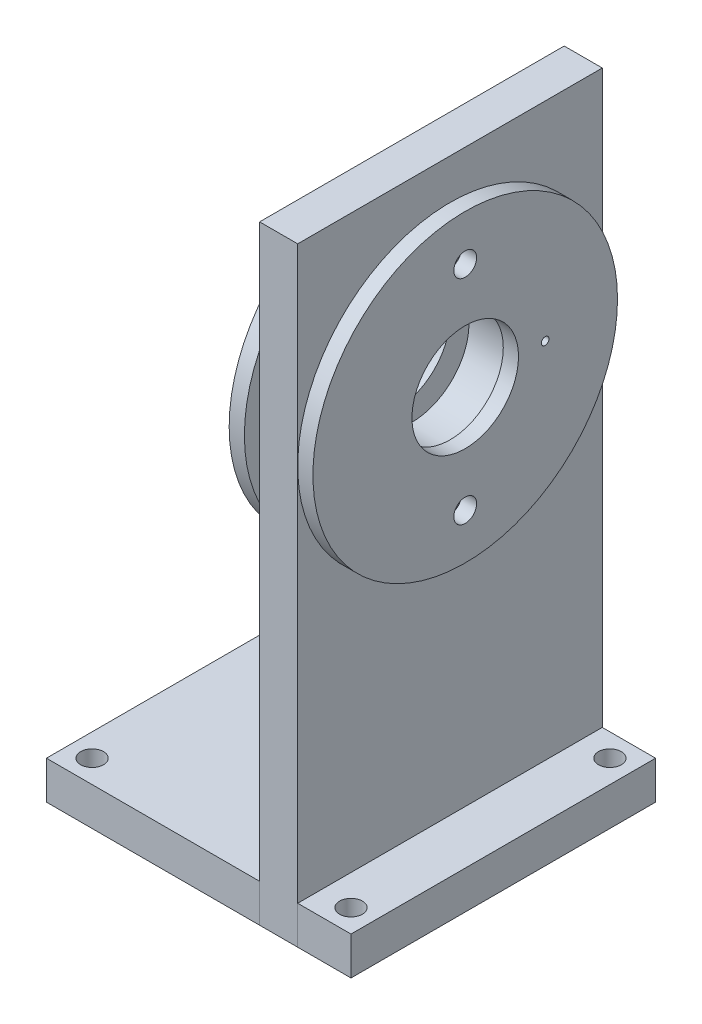
from build123d import *

# Parameters (mm, degrees)
SKETCH1_R           = 7.5
SKETCH1_R_2         = 1
BOSS_EXTRUDE1_DEPTH = 5
SKETCH2_R           = 20
SKETCH2_R_2         = 7
SKETCH2_R_3         = 0.5
SKETCH2_R_4         = 1.5
BOSS_EXTRUDE2_DEPTH = 2
SKETCH4_R           = 20
SKETCH4_R_2         = 1
SKETCH4_R_3         = 1.5
SKETCH4_R_4         = 7
BOSS_EXTRUDE3_DEPTH = 2
SKETCH6_R           = 1.5
SKETCH6_W           = 5
SKETCH6_H           = 14
BOSS_EXTRUDE4_DEPTH = 5


with BuildPart() as part:
    # Sketch1 → Boss-Extrude1 (new body)
    with BuildSketch(Plane(origin=(0, 0, 0), x_dir=(0, 0, -1), z_dir=(1, 0, 0))):
        Polygon((0, 0), (-20, 0), (-20, 80), (20, 80), (20, 0), align=None)
        with Locations((0, 54.7)):
            Circle(SKETCH1_R, mode=Mode.SUBTRACT)
        with Locations((10.5, 54.7)):
            Circle(SKETCH1_R_2, mode=Mode.SUBTRACT)
    extrude(amount=BOSS_EXTRUDE1_DEPTH)


with BuildPart() as body_2:
    # Sketch2 → Boss-Extrude2 (new body)
    with BuildSketch(Plane(origin=(5, 0, 0), x_dir=(0, 0, -1), z_dir=(1, 0, 0))):
        with Locations((0, 54.7)):
            Circle(SKETCH2_R)
        with Locations((0, 54.7)):
            Circle(SKETCH2_R_2, mode=Mode.SUBTRACT)
        with Locations((10.5, 54.7)):
            Circle(SKETCH2_R_3, mode=Mode.SUBTRACT)
        with Locations((0, 68.7)):
            Circle(SKETCH2_R_4, mode=Mode.SUBTRACT)
        with Locations(Location((0, 40.7, 0), (0, 0, 180))):
            Circle(SKETCH2_R_4, mode=Mode.SUBTRACT)
    extrude(amount=BOSS_EXTRUDE2_DEPTH)


with BuildPart() as body_3:
    # Sketch4 → Boss-Extrude3 (new body)
    with BuildSketch(Plane.ZY.offset(2)):
        with Locations((0, 54.7)):
            Circle(SKETCH4_R)
        with Locations((-10.5, 54.7)):
            Circle(SKETCH4_R_2, mode=Mode.SUBTRACT)
        with Locations((0, 40.7)):
            Circle(SKETCH4_R_3, mode=Mode.SUBTRACT)
        with Locations((0, 68.7)):
            Circle(SKETCH4_R_3, mode=Mode.SUBTRACT)
        with Locations((0, 54.7)):
            Circle(SKETCH4_R_4, mode=Mode.SUBTRACT)
    extrude(amount=BOSS_EXTRUDE3_DEPTH)


with BuildPart() as body_4:
    # Sketch6 → Boss-Extrude4 (new body)
    with BuildSketch(Plane.XZ):
        Polygon((0, 20), (12, 20), (12, -20), (-28, -20), (-28, 20), align=None)
        with Locations(Location((-25, 17, 0), (0, 0, 270))):
            Circle(SKETCH6_R, mode=Mode.SUBTRACT)
        with Locations(Location((-25, -17, 0), (0, 0, 90))):
            Circle(SKETCH6_R, mode=Mode.SUBTRACT)
        with Locations(Location((9, -17, 0), (0, 0, 270))):
            Circle(SKETCH6_R, mode=Mode.SUBTRACT)
        with Locations(Location((9, 17, 0), (0, 0, 90))):
            Circle(SKETCH6_R, mode=Mode.SUBTRACT)
        with Locations((2.5, 0)):
            Rectangle(SKETCH6_W, SKETCH6_H, mode=Mode.SUBTRACT)
    extrude(amount=-BOSS_EXTRUDE4_DEPTH)


solid = Compound([part.part, body_2.part, body_3.part, body_4.part])
